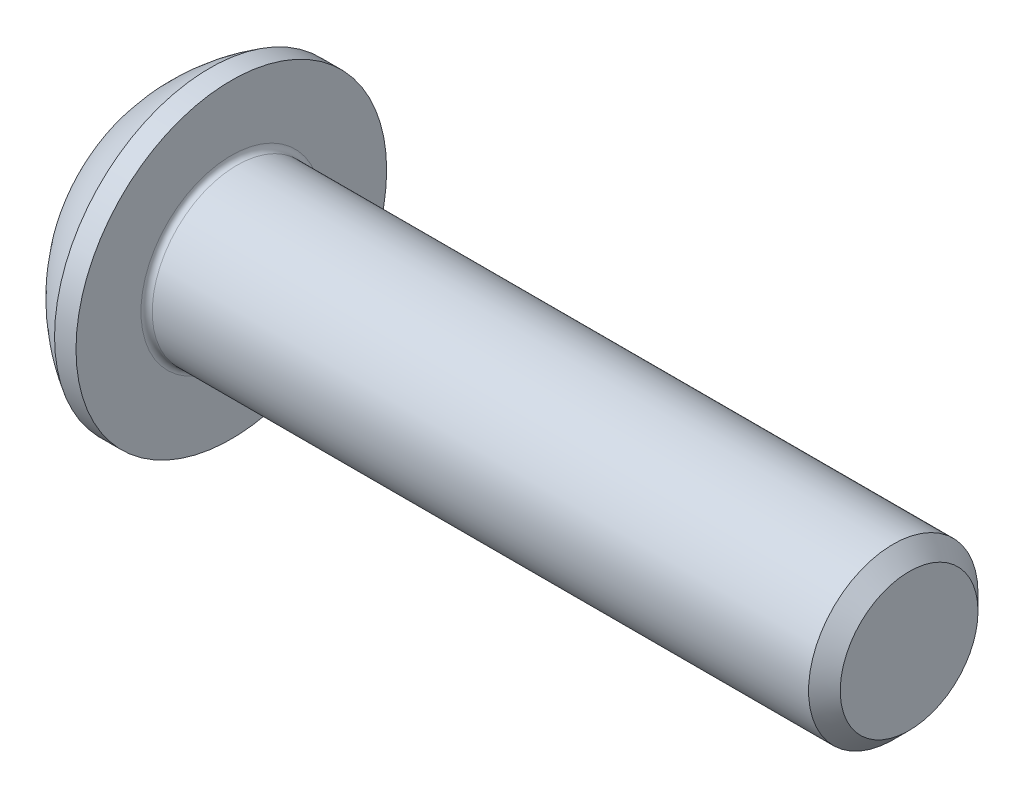
from build123d import *

# Parameters (mm, degrees)
CUT_EXTRUDE1_DEPTH        = 1.04
SKETCH4_R                 = 1.5
LARGO_Y_ANCHO_ROSCA_DEPTH = 12
FILLET1_R                 = 0.1
CHAMFER1_SIZE             = 0.2805


with BuildPart() as part:
    # Sketch1 → Revolve1 (revolve)
    with BuildSketch(Plane(origin=(0, 0, 0), x_dir=(-1, 0, 0), z_dir=(0, 0, -1)), mode=Mode.PRIVATE) as revolve1_sk:
        with BuildLine():
            Line((-1.65, 2.75), (-1.65, 0))
            Line((-1.65, 0), (0, 0))
            Line((0, 0), (0, 1.425))
            ThreePointArc((0, 1.425), (-0.542530893, 2.176130767), (-1.27, 2.75))
            Line((-1.27, 2.75), (-1.65, 2.75))
        make_face()
    revolve(revolve1_sk.sketch.rotate(Axis((1.65, 0, 0), (-1, 0, 0)), 270), axis=Axis((1.65, 0, 0), (-1, 0, 0)))

    # Sketch2 → Cut-Extrude1 (cut)
    with BuildSketch(Plane.ZY):
        Polygon((-1, 0.577350269), (-1, -0.577350269), (0, -1.154700538), (1, -0.577350269), (1, 0.577350269), (0, 1.154700538), align=None)
    extrude(amount=-CUT_EXTRUDE1_DEPTH, mode=Mode.SUBTRACT)

    # Sketch3 → Cut-Revolve1 (revolve, cut)
    with BuildSketch(Plane.XY, mode=Mode.PRIVATE) as cut_revolve1_sk:
        Polygon((1.04, 1), (1.04, 0), (1.617350269, 0), align=None)
    revolve(cut_revolve1_sk.sketch.rotate(Axis((1.04, 0, 0), (1, 0, 0)), 90), axis=Axis((1.04, 0, 0), (1, 0, 0)), mode=Mode.SUBTRACT)

    # Sketch4 → Largo y Ancho rosca (add)
    with BuildSketch(Plane(origin=(1.65, 0, 0), x_dir=(0, 0, -1), z_dir=(1, 0, 0))):
        Circle(SKETCH4_R)
    extrude(amount=LARGO_Y_ANCHO_ROSCA_DEPTH)

    # Fillet1
    fillet1_edges = [part.edges().sort_by_distance(p)[0] for p in [
        (1.65, 0, 1.5),
    ]]
    fillet(fillet1_edges, radius=FILLET1_R)

    # Chamfer1
    chamfer1_edges = [part.edges().sort_by_distance(p)[0] for p in [
        (13.65, 0, 1.5),
    ]]
    chamfer(chamfer1_edges, length=CHAMFER1_SIZE)


solid = part.part
